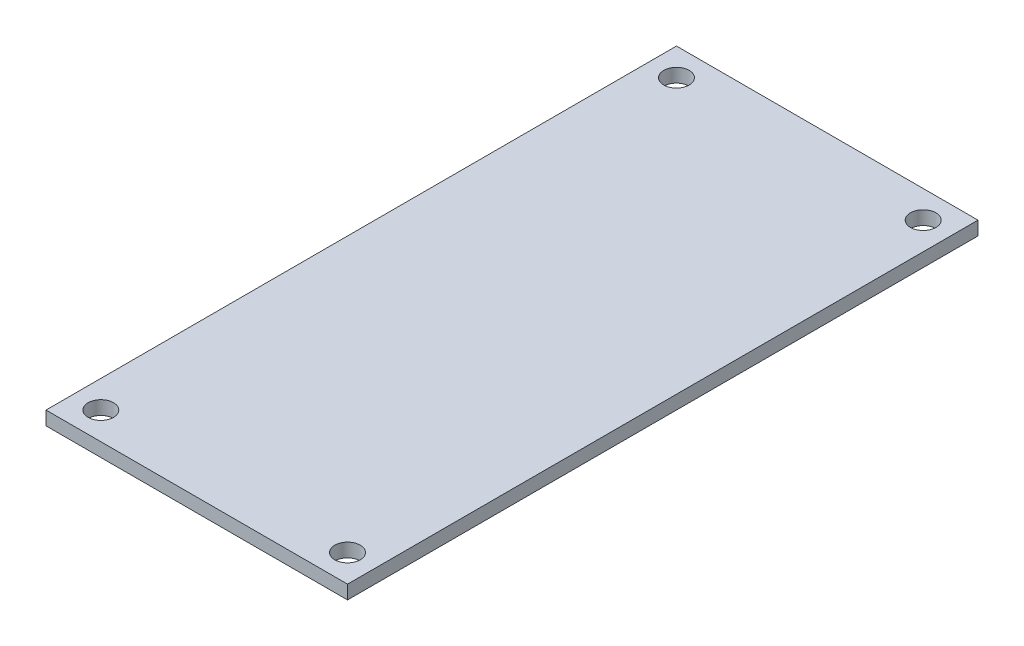
from build123d import *

# Parameters (mm, degrees)
SKETCH1_W           = 34.925
SKETCH1_H           = 73.025
BOSS_EXTRUDE1_DEPTH = 1.5875
SKETCH1_4_R         = 1.4732
CUT_EXTRUDE1_DEPTH  = 1.5875


with BuildPart() as part:
    # Sketch1 → Boss-Extrude1 (new body)
    with BuildSketch(Plane(origin=(0, 0, 0), x_dir=(1, 0, 0), z_dir=(0, 1, 0))):
        with Locations((17.4625, 36.5125)):
            Rectangle(SKETCH1_W, SKETCH1_H)
    extrude(amount=BOSS_EXTRUDE1_DEPTH)

    # Sketch1<4> → Cut-Extrude1 (cut)
    with BuildSketch(Plane(origin=(0, 0, 0), x_dir=(1, 0, 0), z_dir=(0, 1, 0))):
        with Locations((3.175, 69.85)):
            Circle(SKETCH1_4_R)
        with Locations((31.75, 69.85)):
            Circle(SKETCH1_4_R)
        with Locations((3.175, 3.175)):
            Circle(SKETCH1_4_R)
        with Locations((31.75, 3.175)):
            Circle(SKETCH1_4_R)
    extrude(amount=CUT_EXTRUDE1_DEPTH, mode=Mode.SUBTRACT)


solid = part.part
